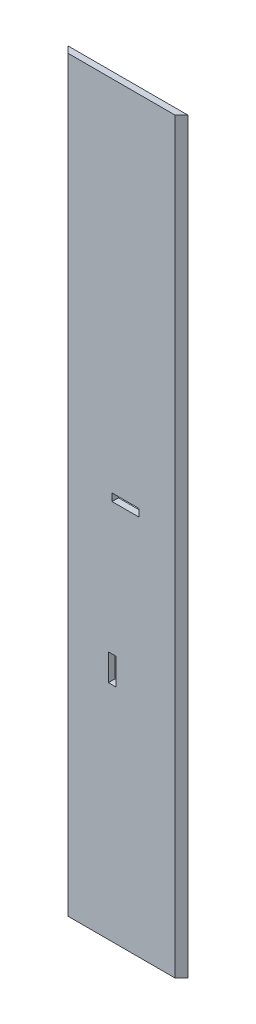
from build123d import *

# Parameters (mm, degrees)
SKETCH1_W           = 350
SKETCH1_H           = 50
BOSS_EXTRUDE1_DEPTH = 3
BOSS_EXTRUDE2_DEPTH = 350
SKETCH3_OUTSIDE_W   = 128.892
SKETCH3_OUTSIDE_H   = 422.892
SKETCH3_OUTSIDE_W_2 = 56
SKETCH3_OUTSIDE_H_2 = 350
SKETCH3_OUTSIDE_W_3 = 3.5
SKETCH3_OUTSIDE_H_3 = 12.5
SKETCH3_OUTSIDE_W_4 = 12.5
SKETCH3_OUTSIDE_H_4 = 3.5
CUT_EXTRUDE2_DEPTH  = 178.251234128


with BuildPart() as part:
    # Sketch1 → Boss-Extrude1 (new body)
    with BuildSketch(Plane(origin=(0, 0, 0), x_dir=(0, 1, 0), z_dir=(0, 0, 1))):
        Rectangle(SKETCH1_W, SKETCH1_H)
    extrude(amount=BOSS_EXTRUDE1_DEPTH)

    # Sketch2 → Boss-Extrude2 (add, through all)
    with BuildSketch(Plane.XZ.offset(175)):
        Polygon((-25, 3), (-25, 0), (-28, 0), align=None)
        Polygon((25, 3), (28, 0), (25, 0), align=None)
    extrude(amount=-BOSS_EXTRUDE2_DEPTH)

    # Sketch3 outside → Cut-Extrude2 (cut, through all)
    # profile 1 of 3: a face of its own
    with BuildSketch(Plane(origin=(0, 0, 0), x_dir=(1, 0, 0), z_dir=(0, 0, -1))):
        Rectangle(SKETCH3_OUTSIDE_W, SKETCH3_OUTSIDE_H)
        Rectangle(SKETCH3_OUTSIDE_W_2, SKETCH3_OUTSIDE_H_2, mode=Mode.SUBTRACT)
    # profile 2 of 3: a face of its own
    with BuildSketch(Plane(origin=(0, 0, 0), x_dir=(1, 0, 0), z_dir=(0, 0, -1))):
        with Locations((-4.440759591, 64.557376571)):
            Rectangle(SKETCH3_OUTSIDE_W_3, SKETCH3_OUTSIDE_H_3)
    # profile 3 of 3: a face of its own
    with BuildSketch(Plane(origin=(0, 0, 0), x_dir=(1, 0, 0), z_dir=(0, 0, -1))):
        with Locations((1.788055669, -5.25)):
            Rectangle(SKETCH3_OUTSIDE_W_4, SKETCH3_OUTSIDE_H_4)
    extrude(amount=-CUT_EXTRUDE2_DEPTH, mode=Mode.SUBTRACT)


solid = part.part
